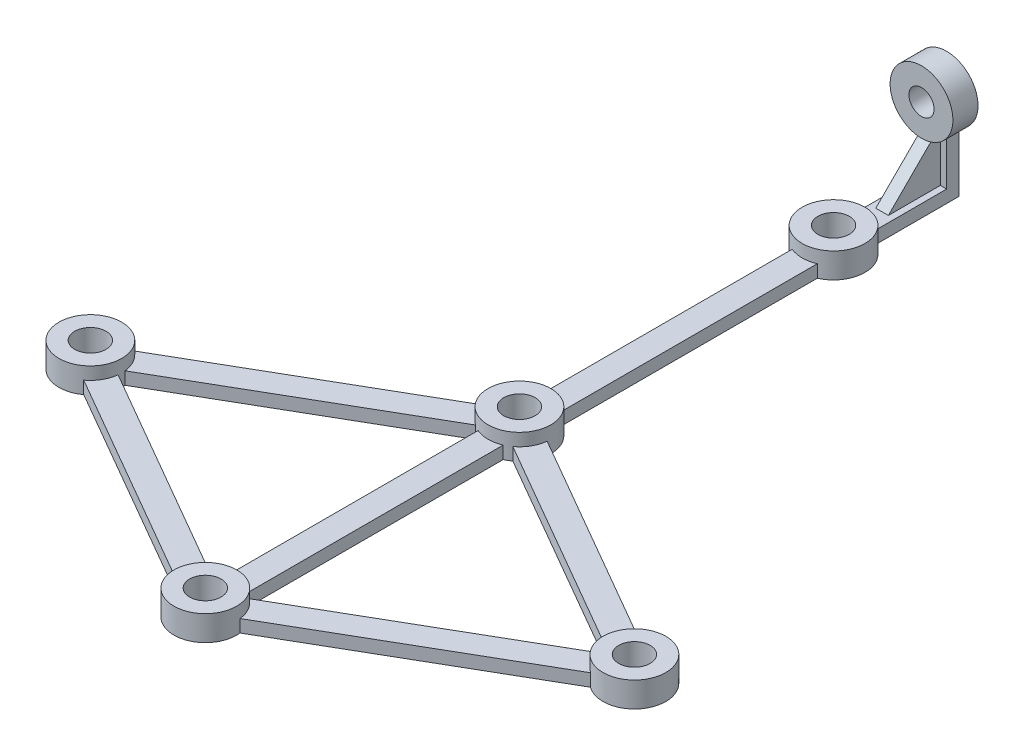
from build123d import *

# Parameters (mm, degrees)
SKETCH_3_W          = 4
SKETCH_3_H          = 120
EXTRUDE_2_DEPTH     = 2
SKETCH_4_R          = 5
EXTRUDE_3_DEPTH     = 4
SKETCH_9_R          = 5
EXTRUDE_7_DEPTH     = 4
EXTRUDE_7_2_DEPTH   = 4
EXTRUDE_8_DEPTH     = 2
SKETCH_5_R          = 2.5
CUT_EXTRUDE_3_DEPTH = 175.851401773
SKETCH_11_W         = 4
SKETCH_11_H         = 2
EXTRUDE_9_DEPTH     = 10
SKETCH_12_R         = 5
EXTRUDE_10_DEPTH    = 4
CUT_EXTRUDE_4_REACH = 135.503
SKETCH_13_R         = 2
RIB_2_REACH         = 179.747
SKETCH_15_WALL_W    = 366.224417408
SKETCH_15_WALL_H    = 2


with BuildPart() as part:
    # Эскиз3 → Бобышка-Вытянуть2 (new body)
    with BuildSketch(Plane(origin=(0, 0, 0), x_dir=(1, 0, 0), z_dir=(0, 1, 0))):
        with Locations((0, 108)):
            Rectangle(SKETCH_3_W, SKETCH_3_H)
    extrude(amount=EXTRUDE_2_DEPTH)

    # Эскиз4 → Бобышка-Вытянуть3 (add)
    with BuildSketch(Plane(origin=(0, 0, 0), x_dir=(1, 0, 0), z_dir=(0, 1, 0))):
        with Locations(Location((0, 52, 0), (0, 0, 113.578178478))):
            Circle(SKETCH_4_R)
        with Locations(Location((0, 102, 0), (0, 0, 66.421821522))):
            Circle(SKETCH_4_R)
        with Locations(Location((0, 152, 0), (0, 0, 66.421821522))):
            Circle(SKETCH_4_R)
    extrude(amount=EXTRUDE_3_DEPTH)



with BuildPart() as body_2:
    # Эскиз9 → Бобышка-Вытянуть7 (new body)
    with BuildSketch(Plane(origin=(0, 0, 0), x_dir=(1, 0, 0), z_dir=(0, 1, 0))):
        with Locations(Location((-43.301270189, 77, 0), (0, 0, 270))):
            Circle(SKETCH_9_R)
    extrude(amount=EXTRUDE_7_DEPTH)


with BuildPart() as body_3:
    # Эскиз9 → Extrude 7 2 (new body)
    with BuildSketch(Plane(origin=(0, 0, 0), x_dir=(1, 0, 0), z_dir=(0, 1, 0))):
        with Locations(Location((43.301270189, 77, 0), (0, 0, 90))):
            Circle(SKETCH_9_R)
    extrude(amount=EXTRUDE_7_2_DEPTH)


with BuildPart() as part_1:
    add(part.part)

    add(body_2.part)  # Бобышка-Вытянуть8 merges body 2

    add(body_3.part)  # Бобышка-Вытянуть8 merges body 3
    # Эскиз10 → Бобышка-Вытянуть8 (add)
    with BuildSketch(Plane(origin=(0, 0, 0), x_dir=(1, 0, 0), z_dir=(0, 1, 0))):
        Polygon((0, 104.309401077), (-47.301270189, 77), (0, 49.690598923), (47.301270189, 77), align=None)
        Polygon((0, 99.690598923), (-39.301270189, 77), (0, 54.309401077), (39.301270189, 77), align=None, mode=Mode.SUBTRACT)
    extrude(amount=EXTRUDE_8_DEPTH)

    # Эскиз5 → Вырез-Вытянуть3 (cut, through all)
    with BuildSketch(Plane(origin=(0, 0, 0), x_dir=(1, 0, 0), z_dir=(0, 1, 0))):
        with Locations(Location((0, 102, 0), (0, 0, 270))):
            Circle(SKETCH_5_R)
        with Locations(Location((0, 52, 0), (0, 0, 270))):
            Circle(SKETCH_5_R)
        with Locations(Location((0, 152, 0), (0, 0, 270))):
            Circle(SKETCH_5_R)
        with Locations(Location((-43.301270189, 77, 0), (0, 0, 270))):
            Circle(SKETCH_5_R)
        with Locations(Location((43.301270189, 77, 0), (0, 0, 270))):
            Circle(SKETCH_5_R)
    extrude(amount=CUT_EXTRUDE_3_DEPTH, mode=Mode.SUBTRACT)

    # Эскиз11 → Бобышка-Вытянуть9 (add)
    with BuildSketch(Plane(origin=(0, 0, 0), x_dir=(1, 0, 0), z_dir=(0, 1, 0))):
        with Locations((0, 169)):
            Rectangle(SKETCH_11_W, SKETCH_11_H)
    extrude(amount=EXTRUDE_9_DEPTH)

    # Эскиз12 → Бобышка-Вытянуть10 (add)
    with BuildSketch(Plane(origin=(0, 0, -170), x_dir=(-1, 0, 0), z_dir=(0, 0, -1))):
        with Locations((0, 14)):
            Circle(SKETCH_12_R)
    extrude(amount=-EXTRUDE_10_DEPTH)

    # Эскиз13 → Вырез-Вытянуть4 (cut, up to next)
    with BuildSketch(Plane(origin=(0, 0, -170), x_dir=(-1, 0, 0), z_dir=(0, 0, -1)), mode=Mode.PRIVATE) as cut_extrude_4_sk1:
        with Locations((0, 14)):
            Circle(SKETCH_13_R)
    cut_extrude_4_tool1 = extrude(cut_extrude_4_sk1.sketch, amount=-CUT_EXTRUDE_4_REACH, mode=Mode.PRIVATE) & part_1.part
    add(cut_extrude_4_tool1.solids().sort_by_distance((0, 14, -170))[0], mode=Mode.SUBTRACT)

    # Эскиз15 wall → Ребро2 (add, up to next)
    with BuildSketch(Plane(origin=(0, 5.650617497, -163.373503951), x_dir=(0, -0.707106781187, 0.707106781187), z_dir=(0, -0.707106781187, -0.707106781187)), mode=Mode.PRIVATE) as rib_2_sk1:
        Rectangle(SKETCH_15_WALL_W, SKETCH_15_WALL_H)
    rib_2_tool1 = extrude(rib_2_sk1.sketch, amount=RIB_2_REACH, mode=Mode.PRIVATE) - part_1.part
    add(rib_2_tool1.solids().sort_by_distance((0, 5.650617497, -163.373503951))[0])


solid = part_1.part
